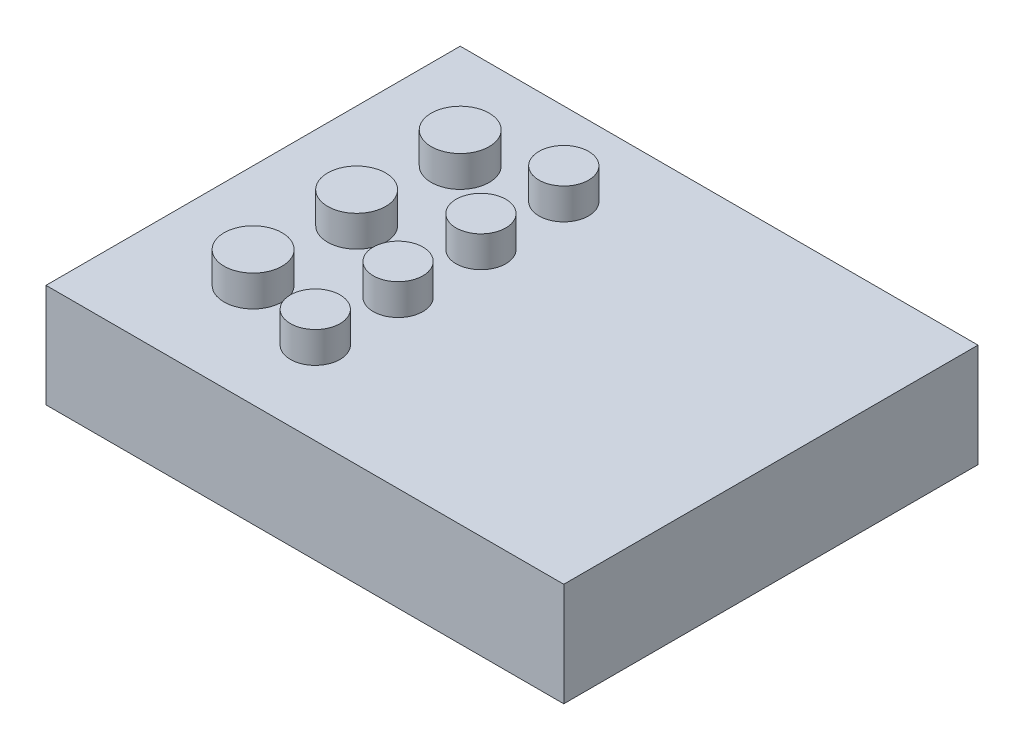
from build123d import *

# Parameters (mm, degrees)
SKETCH2_W           = 31.75
SKETCH2_H           = 25.4
BOSS_EXTRUDE1_DEPTH = 6.35
SKETCH4_R           = 1.778
SKETCH4_R_2         = 1.524
BOSS_EXTRUDE2_DEPTH = 1.905


with BuildPart() as part:
    # Sketch2 → Boss-Extrude1 (new body)
    with BuildSketch(Plane(origin=(0, 0, 0), x_dir=(1, 0, 0), z_dir=(0, 1, 0))):
        with Locations((15.875, 12.7)):
            Rectangle(SKETCH2_W, SKETCH2_H)
    extrude(amount=BOSS_EXTRUDE1_DEPTH)

    # Sketch4 → Boss-Extrude2 (add)
    with BuildSketch(Plane(origin=(0, 6.35, 0), x_dir=(1, 0, 0), z_dir=(0, 1, 0))):
        with Locations(Location((6.35, 6.35, 0), (0, 0, 90))):
            Circle(SKETCH4_R)
        with Locations(Location((6.35, 12.7, 0), (0, 0, 90))):
            Circle(SKETCH4_R)
        with Locations(Location((6.35, 19.05, 0), (0, 0, 90))):
            Circle(SKETCH4_R)
        with Locations(Location((11.43, 20.32, 0), (0, 0, 90))):
            Circle(SKETCH4_R_2)
        with Locations(Location((11.43, 15.24, 0), (0, 0, 90))):
            Circle(SKETCH4_R_2)
        with Locations(Location((11.43, 10.16, 0), (0, 0, 90))):
            Circle(SKETCH4_R_2)
        with Locations(Location((11.43, 5.08, 0), (0, 0, 90))):
            Circle(SKETCH4_R_2)
    extrude(amount=BOSS_EXTRUDE2_DEPTH)


solid = part.part
